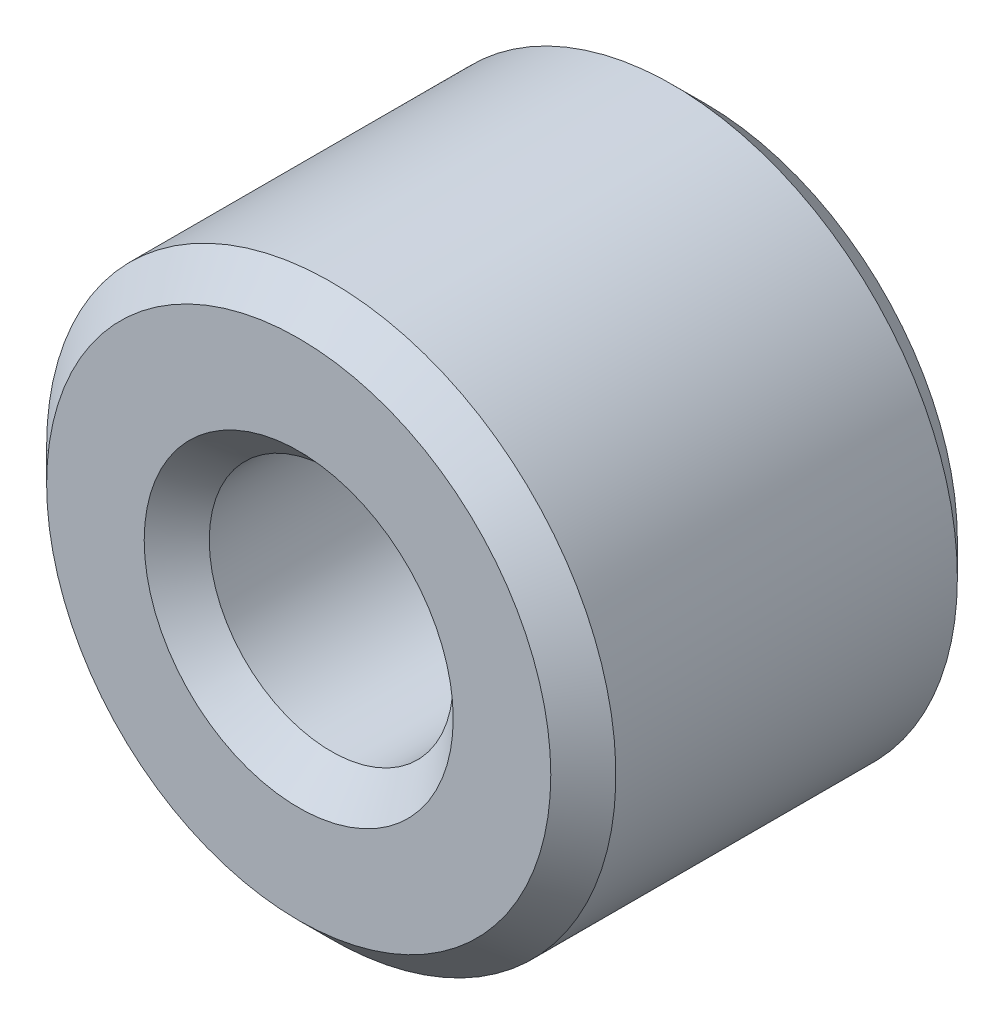
from build123d import *

# Parameters (mm, degrees)
SKETCH_1_R      = 3.5
SKETCH_1_R_2    = 1.5
EXTRUDE_1_DEPTH = 5
CHAMFER_1_SIZE  = 0.4


with BuildPart() as part:
    # 草图1 → 凸台-拉伸1 (new body)
    with BuildSketch(Plane.XY):
        Circle(SKETCH_1_R)
        Circle(SKETCH_1_R_2, mode=Mode.SUBTRACT)
    extrude(amount=EXTRUDE_1_DEPTH)

    # 倒角1
    chamfer_1_edges = [part.edges().sort_by_distance(p)[0] for p in [
        (-3.5, 0, 0),
        (-3.5, 0, 5),
        (-1.5, 0, 0),
        (-1.5, 0, 5),
    ]]
    chamfer(chamfer_1_edges, length=CHAMFER_1_SIZE)


solid = part.part
